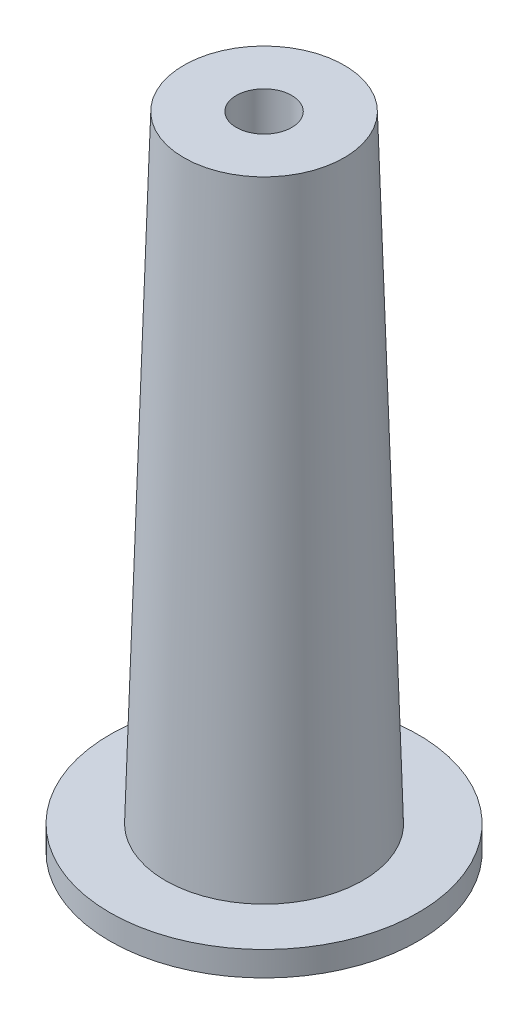
from build123d import *

# Parameters (mm, degrees)
ESQUISSE1_R                  = 25
BOSS_EXTRU_1_DEPTH           = 4
ENL_V_MAT_EXTRU_1_DEPTH      = 107.066017178
ENL_V_MAT_EXTRU_1_DEPTH_BACK = 1.5
ESQUISSE2_R                  = 4.5


with BuildPart() as part:
    # Esquisse1 → Boss.-Extru.1 (new body)
    with BuildSketch(Plane(origin=(0, 0, 0), x_dir=(1, 0, 0), z_dir=(0, 1, 0))):
        Circle(ESQUISSE1_R)
    extrude(amount=BOSS_EXTRU_1_DEPTH)

    # Esquisse3 → Révolution1 (revolve)
    with BuildSketch(Plane(origin=(0, 0, 0), x_dir=(0, 0, -1), z_dir=(1, 0, 0))):
        Polygon((0, 4), (-16, 4), (-13, 104), (0, 104), align=None)
    revolve(axis=Axis((0, 104, 0), (0, -1, 0)))

    # Esquisse2 → Enlèv. mat.-Extru.1 (cut, two sides: drawn at the far end of the back side and taken through both)
    with BuildSketch(Plane(origin=(0, 4, 0), x_dir=(1, 0, 0), z_dir=(0, 1, 0)).offset(-ENL_V_MAT_EXTRU_1_DEPTH_BACK)):
        Circle(ESQUISSE2_R)
    extrude(amount=ENL_V_MAT_EXTRU_1_DEPTH + ENL_V_MAT_EXTRU_1_DEPTH_BACK, mode=Mode.SUBTRACT)


solid = part.part
